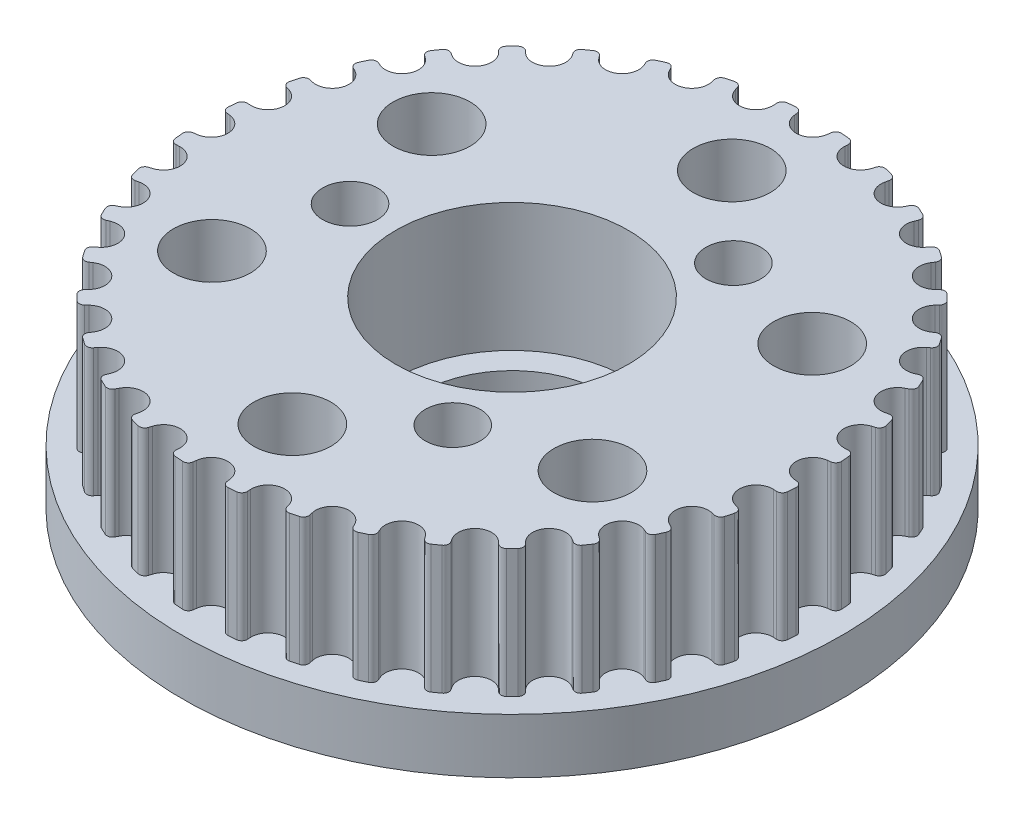
from build123d import *

# Parameters (mm, degrees)
SKETCH_1_R               = 16.8
EXTRUDE_1_DEPTH          = 3.5
CUT_EXTRUDE_1_DEPTH      = 50
PATTERN_CIRCULAR_1_COUNT = 36
SKETCH_4_R               = 6.35
CUT_EXTRUDE_2_DEPTH      = 50
SKETCH_5_R               = 2.1
SKETCH_5_R_2             = 1.5
CUT_EXTRUDE_4_DEPTH      = 25.70705312
SKETCH_6_R               = 18
SKETCH_6_R_2             = 2.1
EXTRUDE_2_DEPTH          = 3
SKETCH_7_R               = 5
CUT_EXTRUDE_5_DEPTH      = 10


with BuildPart() as part:
    # 草图1 → 凸台-拉伸1 (new, symmetric)
    with BuildSketch(Plane(origin=(0, 0, 0), x_dir=(1, 0, 0), z_dir=(0, 1, 0))):
        Circle(SKETCH_1_R)
    extrude(amount=EXTRUDE_1_DEPTH, both=True)

    # 草图2 → 切除-拉伸1 (cut, symmetric)
    with BuildSketch(Plane(origin=(0, 0, 0), x_dir=(1, 0, 0), z_dir=(0, 1, 0))):
        with BuildLine():
            Line((-0.903216998, 16.319098898), (-0.924353128, 16.491238864))
            ThreePointArc((-0.924353128, 16.491238864), (-1.031794245, 16.686577305), (-1.244337282, 16.753854026))
            ThreePointArc((-1.244337282, 16.753854026), (0, 16.8), (1.244337282, 16.753854026))
            ThreePointArc((1.244337282, 16.753854026), (1.031794245, 16.686577305), (0.924353128, 16.491238864))
            Line((0.924353128, 16.491238864), (0.903216998, 16.319098898))
            ThreePointArc((0.903216998, 16.319098898), (0, 15.52), (-0.903216998, 16.319098898))
        make_face()
    cut_extrude_1 = extrude(amount=CUT_EXTRUDE_1_DEPTH, both=True, mode=Mode.SUBTRACT)

    # 阵列(圆周)1: 切除-拉伸1 ×36 about axis
    pattern_circular_1_axis = Axis((0, -44, 0), (0, 1, 0))
    for i in range(1, PATTERN_CIRCULAR_1_COUNT):
        add(cut_extrude_1.rotate(pattern_circular_1_axis, i * 360 / PATTERN_CIRCULAR_1_COUNT), mode=Mode.SUBTRACT)

    # 草图4 → 切除-拉伸2 (cut, symmetric)
    with BuildSketch(Plane(origin=(0, 0, 0), x_dir=(1, 0, 0), z_dir=(0, 1, 0))):
        Circle(SKETCH_4_R)
    extrude(amount=CUT_EXTRUDE_2_DEPTH, both=True, mode=Mode.SUBTRACT)

    # 草图5 → 切除-拉伸4 (cut, through all)
    with BuildSketch(Plane(origin=(0, 3.5, 0), x_dir=(1, 0, 0), z_dir=(0, 1, 0))):
        with Locations((0, 12)):
            Circle(SKETCH_5_R)
        with Locations((10.392304845, 6)):
            Circle(SKETCH_5_R)
        with Locations((10.392304845, -6)):
            Circle(SKETCH_5_R)
        with Locations((0, -12)):
            Circle(SKETCH_5_R)
        with Locations((-10.392304845, -6)):
            Circle(SKETCH_5_R)
        with Locations((-10.392304845, 6)):
            Circle(SKETCH_5_R)
        with Locations((4.425, 7.664324823)):
            Circle(SKETCH_5_R_2)
        with Locations((4.425, -7.664324823)):
            Circle(SKETCH_5_R_2)
        with Locations((-8.85, 0)):
            Circle(SKETCH_5_R_2)
    extrude(amount=-CUT_EXTRUDE_4_DEPTH, mode=Mode.SUBTRACT)


with BuildPart() as body_2:
    # 草图6 → 凸台-拉伸2 (new body)
    with BuildSketch(Plane(origin=(0, -3.5, 0), x_dir=(-1, 0, 0), z_dir=(0, -1, 0))):
        Circle(SKETCH_6_R)
        with Locations((10.392304845, -6)):
            Circle(SKETCH_6_R_2, mode=Mode.SUBTRACT)
        with Locations((10.392304845, 6)):
            Circle(SKETCH_6_R_2, mode=Mode.SUBTRACT)
        with Locations((0, -12)):
            Circle(SKETCH_6_R_2, mode=Mode.SUBTRACT)
        with Locations((-10.392304845, -6)):
            Circle(SKETCH_6_R_2, mode=Mode.SUBTRACT)
        with Locations((-10.392304845, 6)):
            Circle(SKETCH_6_R_2, mode=Mode.SUBTRACT)
        with Locations((0, 12)):
            Circle(SKETCH_6_R_2, mode=Mode.SUBTRACT)
    extrude(amount=EXTRUDE_2_DEPTH)

    # 草图7 → 切除-拉伸5 (cut)
    with BuildSketch(Plane.XZ.offset(6.5)):
        Circle(SKETCH_7_R)
        with BuildLine():
            Line((3.809822407, 8.871042034), (4.981718681, 9.466737536))
            ThreePointArc((4.981718681, 9.466737536), (5.458286424, 9.454029408), (5.707575857, 9.0476637))
            Line((5.707575857, 9.0476637), (5.777636556, 7.734924005))
            ThreePointArc((5.777636556, 7.734924005), (5.777020498, 7.671878316), (5.768475257, 7.609411385))
            Line((5.768475257, 7.609411385), (5.475645102, 6.157700571))
            ThreePointArc((5.475645102, 6.157700571), (5.156716644, 5.78678894), (4.673922157, 5.865530809))
            ThreePointArc((4.673922157, 5.865530809), (3.75, 6.495190528), (2.742737609, 6.980500728))
            ThreePointArc((2.742737609, 6.980500728), (2.433147906, 7.359242084), (2.594902572, 7.820898045))
            Line((2.594902572, 7.820898045), (3.705705939, 8.800351807))
            ThreePointArc((3.705705939, 8.800351807), (3.755531267, 8.838985667), (3.809822407, 8.871042034))
        make_face()
        with BuildLine():
            Line((3.175219068, 11.850078885), (3.750644292, 13.997595058))
            ThreePointArc((3.750644292, 13.997595058), (3.991111223, 14.305444839), (4.37959366, 14.346398829))
            ThreePointArc((4.37959366, 14.346398829), (5.401227479, 13.993810836), (6.394821631, 13.56857606))
            ThreePointArc((6.394821631, 13.56857606), (6.681398794, 13.132478085), (6.423645635, 12.678747744))
            Line((6.423645635, 12.678747744), (3.900166705, 11.283126915))
            ThreePointArc((3.900166705, 11.283126915), (3.350162085, 11.326811845), (3.175219068, 11.850078885))
        make_face()
        with BuildLine():
            Line((8.589870478, 8.589870478), (10.246950766, 10.246950766))
            ThreePointArc((10.246950766, 10.246950766), (10.393323031, 10.609126128), (10.234549009, 10.966038783))
            ThreePointArc((10.234549009, 10.966038783), (9.601239738, 11.524590903), (8.937502599, 12.046619746))
            ThreePointArc((8.937502599, 12.046619746), (8.44849336, 12.107108677), (8.145064694, 11.718881952))
            Line((8.145064694, 11.718881952), (7.741795937, 9.017240066))
            ThreePointArc((7.741795937, 9.017240066), (8.011307825, 8.496914259), (8.589870478, 8.589870478))
        make_face()
        with BuildLine():
            Line((9.587458963, 1.136118029), (10.689294538, 0.419073836))
            ThreePointArc((10.689294538, 0.419073836), (10.916572847, 0), (10.689294538, -0.419073836))
            Line((10.689294538, -0.419073836), (9.587458963, -1.136118029))
            ThreePointArc((9.587458963, -1.136118029), (9.532551765, -1.167107352), (9.474181196, -1.190940421))
            Line((9.474181196, -1.190940421), (8.070547674, -1.663197475))
            ThreePointArc((8.070547674, -1.663197475), (7.58986455, -1.572453144), (7.416659766, -1.114969918))
            ThreePointArc((7.416659766, -1.114969918), (7.5, 0), (7.416659766, 1.114969918))
            ThreePointArc((7.416659766, 1.114969918), (7.58986455, 1.572453144), (8.070547674, 1.663197475))
            Line((8.070547674, 1.663197475), (9.474181196, 1.190940421))
            ThreePointArc((9.474181196, 1.190940421), (9.532551765, 1.167107352), (9.587458963, 1.136118029))
        make_face()
        with BuildLine():
            Line((11.850078885, 3.175219068), (13.997595058, 3.750644292))
            ThreePointArc((13.997595058, 3.750644292), (14.384434255, 3.696318711), (14.614142669, 3.380360047))
            ThreePointArc((14.614142669, 3.380360047), (14.819609419, 2.319305209), (14.948142377, 1.246210045))
            ThreePointArc((14.948142377, 1.246210045), (14.713759034, 0.779977955), (14.191940452, 0.776333568))
            Line((14.191940452, 0.776333568), (11.721557895, 2.263920012))
            ThreePointArc((11.721557895, 2.263920012), (11.484387844, 2.76208045), (11.850078885, 3.175219068))
        make_face()
        with BuildLine():
            Line((11.733981289, -3.14411081), (13.997595058, -3.750644292))
            ThreePointArc((13.997595058, -3.750644292), (14.384434255, -3.696318711), (14.614142669, -3.380360047))
            ThreePointArc((14.614142669, -3.380360047), (14.78120836, -2.55262207), (14.901430029, -1.716794424))
            ThreePointArc((14.901430029, -1.716794424), (14.709310361, -1.263055535), (14.221381821, -1.194391965))
            Line((14.221381821, -1.194391965), (11.680056938, -2.195971919))
            ThreePointArc((11.680056938, -2.195971919), (11.364197515, -2.689538964), (11.733981289, -3.14411081))
        make_face()
        with BuildLine():
            Line((5.777636556, -7.734924005), (5.707575857, -9.0476637))
            ThreePointArc((5.707575857, -9.0476637), (5.458286424, -9.454029408), (4.981718681, -9.466737536))
            Line((4.981718681, -9.466737536), (3.809822407, -8.871042034))
            ThreePointArc((3.809822407, -8.871042034), (3.755531267, -8.838985667), (3.705705939, -8.800351807))
            Line((3.705705939, -8.800351807), (2.594902572, -7.820898045))
            ThreePointArc((2.594902572, -7.820898045), (2.433147906, -7.359242084), (2.742737609, -6.980500728))
            ThreePointArc((2.742737609, -6.980500728), (3.75, -6.495190528), (4.673922157, -5.865530809))
            ThreePointArc((4.673922157, -5.865530809), (5.156716644, -5.78678894), (5.475645102, -6.157700571))
            Line((5.475645102, -6.157700571), (5.768475257, -7.609411385))
            ThreePointArc((5.768475257, -7.609411385), (5.777020498, -7.671878316), (5.777636556, -7.734924005))
        make_face()
        with BuildLine():
            Line((8.674859818, -8.674859818), (10.246950766, -10.246950766))
            ThreePointArc((10.246950766, -10.246950766), (10.393323031, -10.609126128), (10.234549009, -10.966038783))
            ThreePointArc((10.234549009, -10.966038783), (9.41838194, -11.674505627), (8.553320746, -12.322366016))
            ThreePointArc((8.553320746, -12.322366016), (8.03236024, -12.352500131), (7.768294817, -11.902414177))
            Line((7.768294817, -11.902414177), (7.82139119, -9.019206903))
            ThreePointArc((7.82139119, -9.019206903), (8.134225759, -8.564731395), (8.674859818, -8.674859818))
        make_face()
        with BuildLine():
            Line((3.14411081, -11.733981289), (3.750644292, -13.997595058))
            ThreePointArc((3.750644292, -13.997595058), (3.991111223, -14.305444839), (4.37959366, -14.346398829))
            ThreePointArc((4.37959366, -14.346398829), (5.179968621, -14.077212973), (5.96392743, -13.76341417))
            ThreePointArc((5.96392743, -13.76341417), (6.260817, -13.370164212), (6.076317127, -12.913273916))
            Line((6.076317127, -12.913273916), (3.938261001, -11.213211985))
            ThreePointArc((3.938261001, -11.213211985), (3.35288969, -11.186453223), (3.14411081, -11.733981289))
        make_face()
        with BuildLine():
            Line((-3.809822407, -8.871042034), (-4.981718681, -9.466737536))
            ThreePointArc((-4.981718681, -9.466737536), (-5.458286424, -9.454029408), (-5.707575857, -9.0476637))
            Line((-5.707575857, -9.0476637), (-5.777636556, -7.734924005))
            ThreePointArc((-5.777636556, -7.734924005), (-5.777020498, -7.671878316), (-5.768475257, -7.609411385))
            Line((-5.768475257, -7.609411385), (-5.475645102, -6.157700571))
            ThreePointArc((-5.475645102, -6.157700571), (-5.156716644, -5.78678894), (-4.673922157, -5.865530809))
            ThreePointArc((-4.673922157, -5.865530809), (-3.75, -6.495190528), (-2.742737609, -6.980500728))
            ThreePointArc((-2.742737609, -6.980500728), (-2.433147906, -7.359242084), (-2.594902572, -7.820898045))
            Line((-2.594902572, -7.820898045), (-3.705705939, -8.800351807))
            ThreePointArc((-3.705705939, -8.800351807), (-3.755531267, -8.838985667), (-3.809822407, -8.871042034))
        make_face()
        with BuildLine():
            Line((-3.175219068, -11.850078885), (-3.750644292, -13.997595058))
            ThreePointArc((-3.750644292, -13.997595058), (-3.991111223, -14.305444839), (-4.37959366, -14.346398829))
            ThreePointArc((-4.37959366, -14.346398829), (-5.401227479, -13.993810836), (-6.394821631, -13.56857606))
            ThreePointArc((-6.394821631, -13.56857606), (-6.681398794, -13.132478085), (-6.423645635, -12.678747744))
            Line((-6.423645635, -12.678747744), (-3.900166705, -11.283126915))
            ThreePointArc((-3.900166705, -11.283126915), (-3.350162085, -11.326811845), (-3.175219068, -11.850078885))
        make_face()
        with BuildLine():
            Line((-8.589870478, -8.589870478), (-10.246950766, -10.246950766))
            ThreePointArc((-10.246950766, -10.246950766), (-10.393323031, -10.609126128), (-10.234549009, -10.966038783))
            ThreePointArc((-10.234549009, -10.966038783), (-9.601239738, -11.524590903), (-8.937502599, -12.046619746))
            ThreePointArc((-8.937502599, -12.046619746), (-8.44849336, -12.107108677), (-8.145064694, -11.718881952))
            Line((-8.145064694, -11.718881952), (-7.741795937, -9.017240066))
            ThreePointArc((-7.741795937, -9.017240066), (-8.011307825, -8.496914259), (-8.589870478, -8.589870478))
        make_face()
        with BuildLine():
            Line((-9.587458963, -1.136118029), (-10.689294538, -0.419073836))
            ThreePointArc((-10.689294538, -0.419073836), (-10.916572847, 0), (-10.689294538, 0.419073836))
            Line((-10.689294538, 0.419073836), (-9.587458963, 1.136118029))
            ThreePointArc((-9.587458963, 1.136118029), (-9.532551765, 1.167107352), (-9.474181196, 1.190940421))
            Line((-9.474181196, 1.190940421), (-8.070547674, 1.663197475))
            ThreePointArc((-8.070547674, 1.663197475), (-7.58986455, 1.572453144), (-7.416659766, 1.114969918))
            ThreePointArc((-7.416659766, 1.114969918), (-7.5, 0), (-7.416659766, -1.114969918))
            ThreePointArc((-7.416659766, -1.114969918), (-7.58986455, -1.572453144), (-8.070547674, -1.663197475))
            Line((-8.070547674, -1.663197475), (-9.474181196, -1.190940421))
            ThreePointArc((-9.474181196, -1.190940421), (-9.532551765, -1.167107352), (-9.587458963, -1.136118029))
        make_face()
        with BuildLine():
            Line((-11.850078885, -3.175219068), (-13.997595058, -3.750644292))
            ThreePointArc((-13.997595058, -3.750644292), (-14.384434255, -3.696318711), (-14.614142669, -3.380360047))
            ThreePointArc((-14.614142669, -3.380360047), (-14.819609419, -2.319305209), (-14.948142377, -1.246210045))
            ThreePointArc((-14.948142377, -1.246210045), (-14.713759034, -0.779977955), (-14.191940452, -0.776333568))
            Line((-14.191940452, -0.776333568), (-11.721557895, -2.263920012))
            ThreePointArc((-11.721557895, -2.263920012), (-11.484387844, -2.76208045), (-11.850078885, -3.175219068))
        make_face()
        with BuildLine():
            Line((-11.733981289, 3.14411081), (-13.997595058, 3.750644292))
            ThreePointArc((-13.997595058, 3.750644292), (-14.384434255, 3.696318711), (-14.614142669, 3.380360047))
            ThreePointArc((-14.614142669, 3.380360047), (-14.78120836, 2.55262207), (-14.901430029, 1.716794424))
            ThreePointArc((-14.901430029, 1.716794424), (-14.709310361, 1.263055535), (-14.221381821, 1.194391965))
            Line((-14.221381821, 1.194391965), (-11.680056938, 2.195971919))
            ThreePointArc((-11.680056938, 2.195971919), (-11.364197515, 2.689538964), (-11.733981289, 3.14411081))
        make_face()
        with BuildLine():
            Line((-5.777636556, 7.734924005), (-5.707575857, 9.0476637))
            ThreePointArc((-5.707575857, 9.0476637), (-5.458286424, 9.454029408), (-4.981718681, 9.466737536))
            Line((-4.981718681, 9.466737536), (-3.809822407, 8.871042034))
            ThreePointArc((-3.809822407, 8.871042034), (-3.755531267, 8.838985667), (-3.705705939, 8.800351807))
            Line((-3.705705939, 8.800351807), (-2.594902572, 7.820898045))
            ThreePointArc((-2.594902572, 7.820898045), (-2.433147906, 7.359242084), (-2.742737609, 6.980500728))
            ThreePointArc((-2.742737609, 6.980500728), (-3.75, 6.495190528), (-4.673922157, 5.865530809))
            ThreePointArc((-4.673922157, 5.865530809), (-5.156716644, 5.78678894), (-5.475645102, 6.157700571))
            Line((-5.475645102, 6.157700571), (-5.768475257, 7.609411385))
            ThreePointArc((-5.768475257, 7.609411385), (-5.777020498, 7.671878316), (-5.777636556, 7.734924005))
        make_face()
        with BuildLine():
            Line((-8.674859818, 8.674859818), (-10.246950766, 10.246950766))
            ThreePointArc((-10.246950766, 10.246950766), (-10.393323031, 10.609126128), (-10.234549009, 10.966038783))
            ThreePointArc((-10.234549009, 10.966038783), (-9.41838194, 11.674505627), (-8.553320746, 12.322366016))
            ThreePointArc((-8.553320746, 12.322366016), (-8.03236024, 12.352500131), (-7.768294817, 11.902414177))
            Line((-7.768294817, 11.902414177), (-7.82139119, 9.019206903))
            ThreePointArc((-7.82139119, 9.019206903), (-8.134225759, 8.564731395), (-8.674859818, 8.674859818))
        make_face()
        with BuildLine():
            Line((-3.14411081, 11.733981289), (-3.750644292, 13.997595058))
            ThreePointArc((-3.750644292, 13.997595058), (-3.991111223, 14.305444839), (-4.37959366, 14.346398829))
            ThreePointArc((-4.37959366, 14.346398829), (-5.179968621, 14.077212973), (-5.96392743, 13.76341417))
            ThreePointArc((-5.96392743, 13.76341417), (-6.260817, 13.370164212), (-6.076317127, 12.913273916))
            Line((-6.076317127, 12.913273916), (-3.938261001, 11.213211985))
            ThreePointArc((-3.938261001, 11.213211985), (-3.35288969, 11.186453223), (-3.14411081, 11.733981289))
        make_face()
    extrude(amount=-CUT_EXTRUDE_5_DEPTH, mode=Mode.SUBTRACT)


solid = Compound([part.part, body_2.part])
